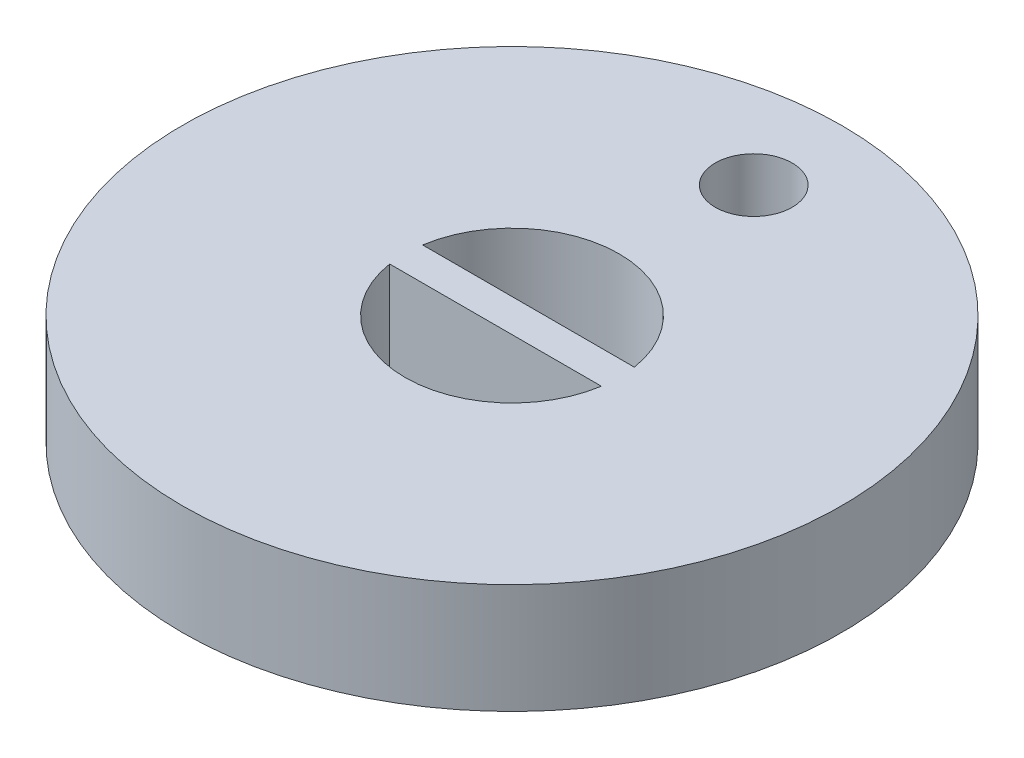
from build123d import *

# Parameters (mm, degrees)
SKETCH1_R           = 6
BOSS_EXTRUDE1_DEPTH = 2
CUT_EXTRUDE1_DEPTH  = 4
SKETCH3_R           = 0.7
CUT_EXTRUDE2_DEPTH  = 4


with BuildPart() as part:
    # Sketch1 → Boss-Extrude1 (new body)
    with BuildSketch(Plane(origin=(0, 0, 0), x_dir=(1, 0, 0), z_dir=(0, 1, 0))):
        with Locations(Location((0, 0, 0), (0, 0, 270))):
            Circle(SKETCH1_R)
    extrude(amount=BOSS_EXTRUDE1_DEPTH)

    # Sketch2 → Cut-Extrude1 (cut)
    with BuildSketch(Plane(origin=(0, 2, 0), x_dir=(1, 0, 0), z_dir=(0, 1, 0))):
        with BuildLine():
            Line((-1.926784887, 0.3), (0, 0.3))
            Line((0, 0.3), (1.926784887, 0.3))
            ThreePointArc((1.926784887, 0.3), (0, 1.95), (-1.926784887, 0.3))
        make_face()
        with BuildLine():
            Line((1.926784887, -0.3), (0, -0.3))
            Line((0, -0.3), (-1.926784887, -0.3))
            ThreePointArc((-1.926784887, -0.3), (0, -1.95), (1.926784887, -0.3))
        make_face()
    extrude(amount=-CUT_EXTRUDE1_DEPTH, mode=Mode.SUBTRACT)

    # Sketch3 → Cut-Extrude2 (cut)
    with BuildSketch(Plane(origin=(0, 2, 0), x_dir=(1, 0, 0), z_dir=(0, 1, 0))):
        with Locations(Location((0.143622542, 4.257382495, 0), (0, 0, 270))):
            Circle(SKETCH3_R)
    extrude(amount=-CUT_EXTRUDE2_DEPTH, mode=Mode.SUBTRACT)


solid = part.part
